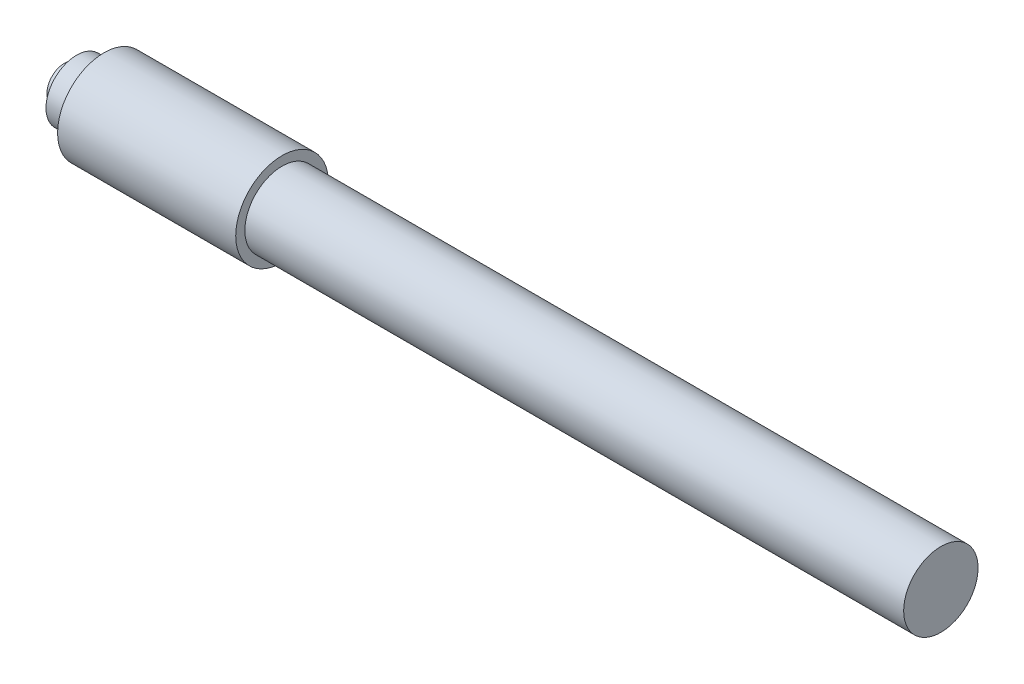
from build123d import *


with BuildPart() as part:
    # Esquisse1 → Révolution1 (revolve)
    with BuildSketch(Plane.XY, mode=Mode.PRIVATE) as r_volution1_sk:
        Polygon((0, 0), (0, 2.85), (2, 2.85), (2, 5), (6.5, 5), (6.5, 7.6), (35.7, 7.6), (35.7, 6.1), (143.7, 6.1), (143.7, 0), align=None)
    revolve(r_volution1_sk.sketch.rotate(Axis((0, 0, 0), (1, 0, 0)), 90), axis=Axis((0, 0, 0), (1, 0, 0)))


solid = part.part
